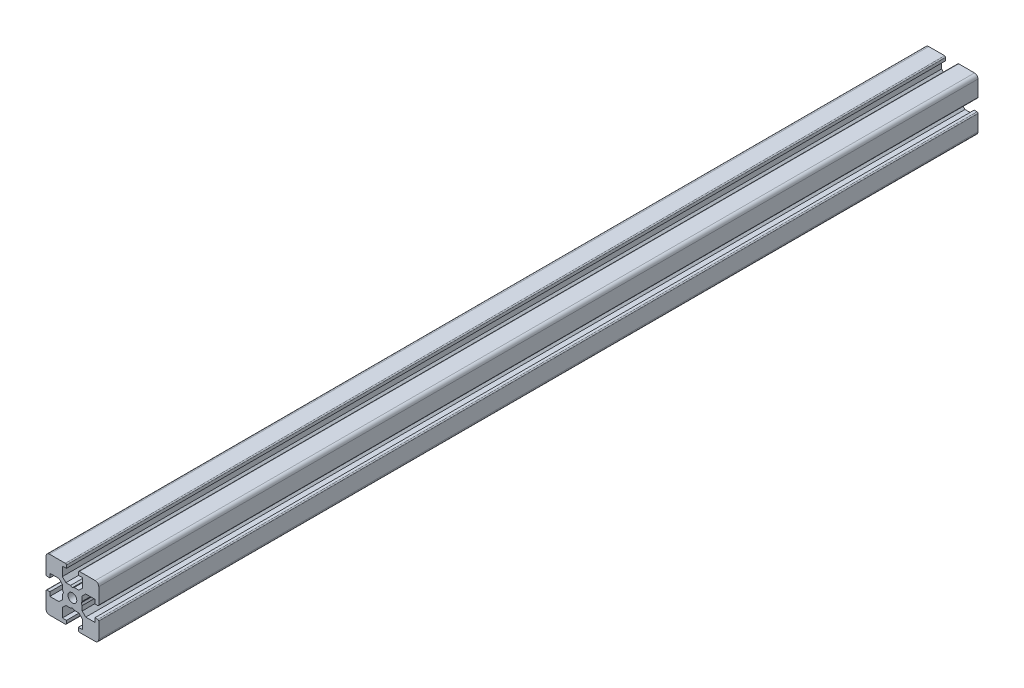
from build123d import *

# Parameters (mm, degrees)
SKETCH1_R           = 1.25
BOSS_EXTRUDE1_DEPTH = 250


with BuildPart() as part:
    # Sketch1 → Boss-Extrude1 (new body)
    with BuildSketch(Plane.XY.offset(300)):
        with BuildLine():
            Line((-7.5, 6.5), (-7.5, 2))
            ThreePointArc((-7.5, 2), (-7.412132034, 1.787867966), (-7.2, 1.7))
            Line((-7.2, 1.7), (-6.4, 1.7))
            Line((-6.4, 1.7), (-6.4, 2.85))
            Line((-6.4, 2.85), (-3.8, 2.85))
            Line((-3.8, 2.85), (-2.8, 1.85))
            Line((-2.8, 1.85), (-2.8, 0.519615242))
            Line((-2.8, 0.519615242), (-2.5, 0))
            Line((-2.5, 0), (-2.8, -0.519615242))
            Line((-2.8, -0.519615242), (-2.8, -1.85))
            Line((-2.8, -1.85), (-3.8, -2.85))
            Line((-3.8, -2.85), (-6.4, -2.85))
            Line((-6.4, -2.85), (-6.4, -1.7))
            Line((-6.4, -1.7), (-7.2, -1.7))
            ThreePointArc((-7.2, -1.7), (-7.412132034, -1.787867966), (-7.5, -2))
            Line((-7.5, -2), (-7.5, -6.5))
            ThreePointArc((-7.5, -6.5), (-7.207106781, -7.207106781), (-6.5, -7.5))
            Line((-6.5, -7.5), (-2, -7.5))
            ThreePointArc((-2, -7.5), (-1.787867966, -7.412132034), (-1.7, -7.2))
            Line((-1.7, -7.2), (-1.7, -6.4))
            Line((-1.7, -6.4), (-2.85, -6.4))
            Line((-2.85, -6.4), (-2.85, -3.8))
            Line((-2.85, -3.8), (-1.85, -2.8))
            Line((-1.85, -2.8), (-0.519615242, -2.8))
            Line((-0.519615242, -2.8), (0, -2.5))
            Line((0, -2.5), (0.519615242, -2.8))
            Line((0.519615242, -2.8), (1.85, -2.8))
            Line((1.85, -2.8), (2.85, -3.8))
            Line((2.85, -3.8), (2.85, -6.4))
            Line((2.85, -6.4), (1.7, -6.4))
            Line((1.7, -6.4), (1.7, -7.2))
            ThreePointArc((1.7, -7.2), (1.787867966, -7.412132034), (2, -7.5))
            Line((2, -7.5), (6.5, -7.5))
            ThreePointArc((6.5, -7.5), (7.207106781, -7.207106781), (7.5, -6.5))
            Line((7.5, -6.5), (7.5, -2))
            ThreePointArc((7.5, -2), (7.412132034, -1.787867966), (7.2, -1.7))
            Line((7.2, -1.7), (6.4, -1.7))
            Line((6.4, -1.7), (6.4, -2.85))
            Line((6.4, -2.85), (3.8, -2.85))
            Line((3.8, -2.85), (2.8, -1.85))
            Line((2.8, -1.85), (2.8, -0.519615242))
            Line((2.8, -0.519615242), (2.5, 0))
            Line((2.5, 0), (2.8, 0.519615242))
            Line((2.8, 0.519615242), (2.8, 1.85))
            Line((2.8, 1.85), (3.8, 2.85))
            Line((3.8, 2.85), (6.4, 2.85))
            Line((6.4, 2.85), (6.4, 1.7))
            Line((6.4, 1.7), (7.2, 1.7))
            ThreePointArc((7.2, 1.7), (7.412132034, 1.787867966), (7.5, 2))
            Line((7.5, 2), (7.5, 6.5))
            ThreePointArc((7.5, 6.5), (7.207106781, 7.207106781), (6.5, 7.5))
            Line((6.5, 7.5), (2, 7.5))
            ThreePointArc((2, 7.5), (1.787867966, 7.412132034), (1.7, 7.2))
            Line((1.7, 7.2), (1.7, 6.4))
            Line((1.7, 6.4), (2.85, 6.4))
            Line((2.85, 6.4), (2.85, 3.8))
            Line((2.85, 3.8), (1.85, 2.8))
            Line((1.85, 2.8), (0.519615242, 2.8))
            Line((0.519615242, 2.8), (0, 2.5))
            Line((0, 2.5), (-0.519615242, 2.8))
            Line((-0.519615242, 2.8), (-1.85, 2.8))
            Line((-1.85, 2.8), (-2.85, 3.8))
            Line((-2.85, 3.8), (-2.85, 6.4))
            Line((-2.85, 6.4), (-1.7, 6.4))
            Line((-1.7, 6.4), (-1.7, 7.2))
            ThreePointArc((-1.7, 7.2), (-1.787867966, 7.412132034), (-2, 7.5))
            Line((-2, 7.5), (-6.5, 7.5))
            ThreePointArc((-6.5, 7.5), (-7.207106781, 7.207106781), (-7.5, 6.5))
        make_face()
        with Locations(Location((0, 0, 0), (0, 0, 180))):
            Circle(SKETCH1_R, mode=Mode.SUBTRACT)
    extrude(amount=-BOSS_EXTRUDE1_DEPTH)


solid = part.part
